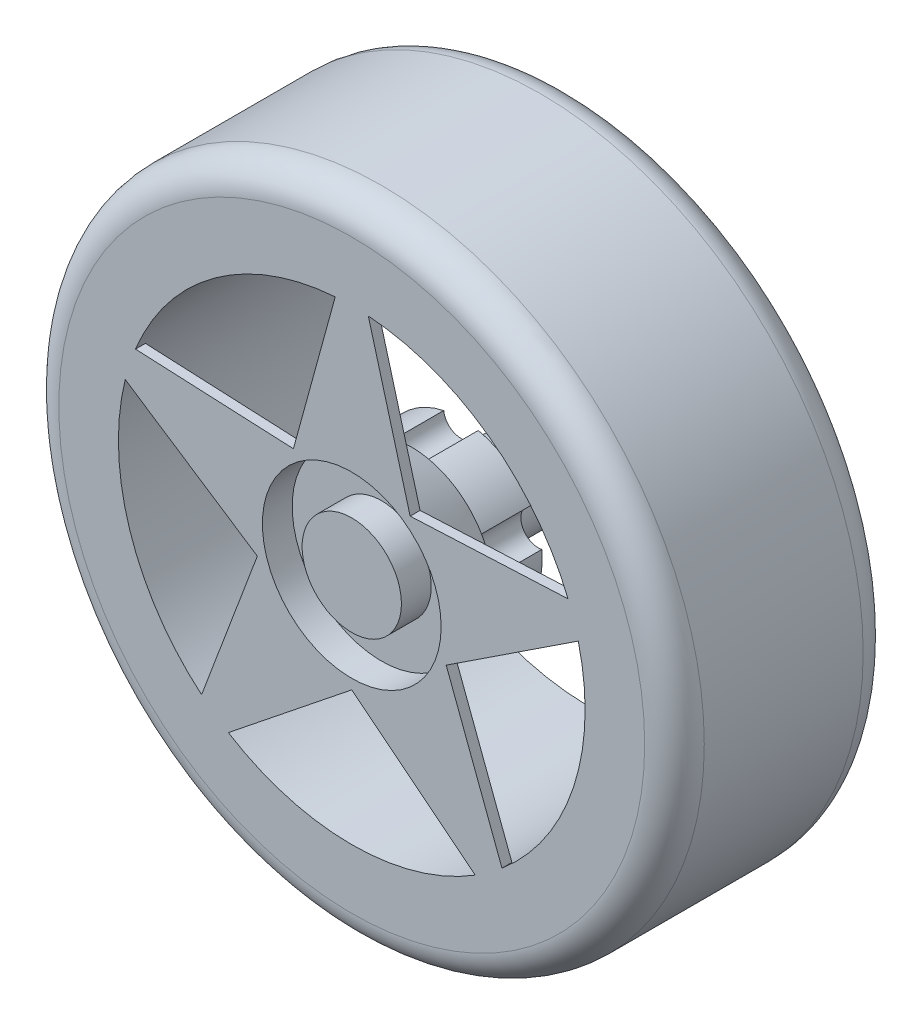
from build123d import *

# Parameters (mm, degrees)
SKETCH_1_R          = 4
EXTRUDE_1_DEPTH     = 30
SKETCH_2_R          = 10
EXTRUDE_2_DEPTH     = 5
DRAFT_1_ANGLE       = -20
EXTRUDE_3_DEPTH     = 5
EXTRUDE_4_DEPTH     = 1
SKETCH_5_R          = 25
SKETCH_5_R_2        = 23.5
EXTRUDE_5_DEPTH     = 24
SKETCH_6_R          = 9
SKETCH_6_R_2        = 5
CUT_EXTRUDE_1_DEPTH = 3
SKETCH_7_R          = 32.5
SKETCH_7_R_2        = 25
EXTRUDE_6_DEPTH     = 22
FILLET_1_R          = 3


with BuildPart() as part:
    # 草图1 → 凸台-拉伸1 (new body)
    with BuildSketch(Plane.XY):
        Circle(SKETCH_1_R)
        with BuildLine():
            Line((-2.336533326, -1.353001115), (2.336533326, -1.353001115))
            ThreePointArc((2.336533326, -1.353001115), (2.699997774, -0.003466674), (2.34, 1.346996659))
            Line((2.34, 1.346996659), (-2.34, 1.346996659))
            ThreePointArc((-2.34, 1.346996659), (-2.699997774, -0.003466674), (-2.336533326, -1.353001115))
        make_face(mode=Mode.SUBTRACT)
    extrude(amount=EXTRUDE_1_DEPTH)

    # 草图2 → 凸台-拉伸2 (add)
    with BuildSketch(Plane.XY.offset(30)):
        Circle(SKETCH_2_R)
    extrude(amount=EXTRUDE_2_DEPTH)

    # 拔模1
    draft_1_faces = [part.faces().sort_by_distance(p)[0] for p in [
        (-10, 0, 32.5),
    ]]
    draft(draft_1_faces, Plane.XY.offset(35), DRAFT_1_ANGLE)

    # 草图3 → 凸台-拉伸3 (add)
    with BuildSketch(Plane(origin=(0, 0, 30), x_dir=(-1, 0, 0), z_dir=(0, 0, -1))):
        with BuildLine():
            ThreePointArc((-8.139286856, 0.815113167), (-7.779642303, -2.527759014), (-6.10570989, -5.443593183))
            ThreePointArc((-6.10570989, -5.443593183), (-3.779459172, -5.201979274), (-3.29039665, -7.489037981))
            ThreePointArc((-3.29039665, -7.489037981), (0, -8.18), (3.29039665, -7.489037981))
            ThreePointArc((3.29039665, -7.489037981), (3.779459172, -5.201979274), (6.10570989, -5.443593183))
            ThreePointArc((6.10570989, -5.443593183), (7.779642303, -2.527759014), (8.139286856, 0.815113167))
            ThreePointArc((8.139286856, 0.815113167), (6.1152934, 1.986979274), (7.063932887, 4.124712373))
            ThreePointArc((7.063932887, 4.124712373), (4.808083364, 6.617759014), (1.739959271, 7.992805623))
            ThreePointArc((1.739959271, 7.992805623), (0, 6.43), (-1.739959271, 7.992805623))
            ThreePointArc((-1.739959271, 7.992805623), (-4.808083364, 6.617759014), (-7.063932887, 4.124712373))
            ThreePointArc((-7.063932887, 4.124712373), (-6.1152934, 1.986979274), (-8.139286856, 0.815113167))
        make_face()
    extrude(amount=EXTRUDE_3_DEPTH)

    # 草图4 → 凸台-拉伸4 (add)
    with BuildSketch(Plane.XY.offset(35)):
        Polygon((-1.375, 24.5), (1.375, 24.5), (5.877852523, 8.090169944), (22.875986282, 8.878619072), (23.725783016, 6.263213652), (9.510565163, -3.090169944), (15.513137048, -19.01271164), (13.288340314, -20.629121084), (0, -10), (-13.288340314, -20.629121084), (-15.513137048, -19.01271164), (-9.510565163, -3.090169944), (-23.725783016, 6.263213652), (-22.875986282, 8.878619072), (-5.877852523, 8.090169944), align=None)
    extrude(amount=EXTRUDE_4_DEPTH)

    # 草图5 → 凸台-拉伸5 (add)
    with BuildSketch(Plane.XY.offset(36)):
        Circle(SKETCH_5_R)
        Circle(SKETCH_5_R_2, mode=Mode.SUBTRACT)
    extrude(amount=-EXTRUDE_5_DEPTH)

    # 草图6 → 切除-拉伸1 (cut)
    with BuildSketch(Plane.XY.offset(36)):
        Circle(SKETCH_6_R)
        Circle(SKETCH_6_R_2, mode=Mode.SUBTRACT)
    extrude(amount=-CUT_EXTRUDE_1_DEPTH, mode=Mode.SUBTRACT)

    # 草图7 → 凸台-拉伸6 (add)
    with BuildSketch(Plane.XY.offset(36)):
        Circle(SKETCH_7_R)
        Circle(SKETCH_7_R_2, mode=Mode.SUBTRACT)
    extrude(amount=-EXTRUDE_6_DEPTH)

    # 圆角1
    fillet_1_edges = [part.edges().sort_by_distance(p)[0] for p in [
        (-32.5, 0, 14),
        (-32.5, 0, 36),
    ]]
    fillet(fillet_1_edges, radius=FILLET_1_R)


solid = part.part
